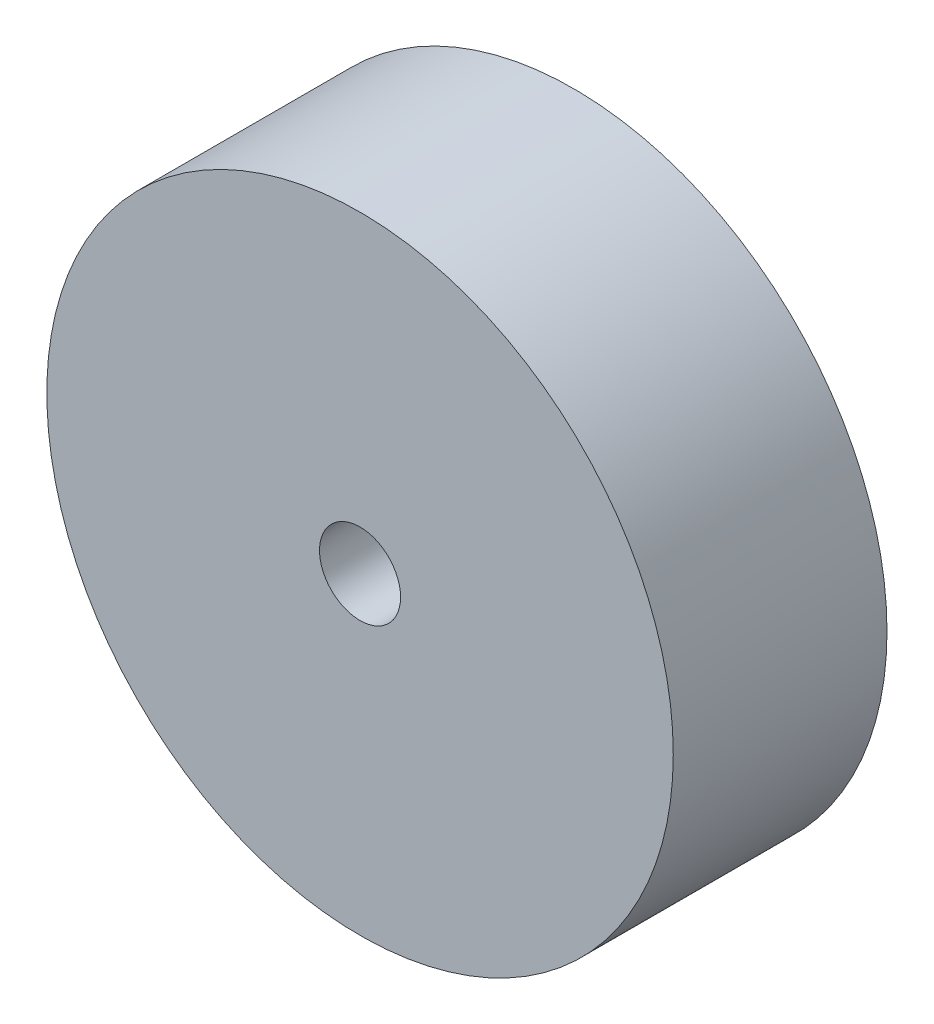
from build123d import *

# Parameters (mm, degrees)
SKETCH1_R           = 8.5
BOSS_EXTRUDE1_DEPTH = 5.8
SKETCH2_R           = 8
CUT_EXTRUDE1_DEPTH  = 3.2
SKETCH3_R           = 1
BOSS_EXTRUDE2_DEPTH = 3.2
CHAMFER1_SIZE       = 2.65
CHAMFER1_SIZE2      = 3.048476279
SKETCH4_R           = 2.1
BOSS_EXTRUDE3_DEPTH = 3
SKETCH5_R           = 0.85
CUT_EXTRUDE2_DEPTH  = 40.372371259
SKETCH6_R           = 1.1
CUT_EXTRUDE3_DEPTH  = 3


with BuildPart() as part:
    # Sketch1 → Boss-Extrude1 (new body)
    with BuildSketch(Plane.XY):
        with Locations((-29.082250471, -1.703826149)):
            Circle(SKETCH1_R)
    extrude(amount=BOSS_EXTRUDE1_DEPTH)

    # Sketch2 → Cut-Extrude1 (cut)
    with BuildSketch(Plane(origin=(0, 0, 0), x_dir=(-1, 0, 0), z_dir=(0, 0, -1))):
        with Locations((29.082250471, -1.703826149)):
            Circle(SKETCH2_R)
    extrude(amount=-CUT_EXTRUDE1_DEPTH, mode=Mode.SUBTRACT)

    # Sketch3 → Boss-Extrude2 (add)
    with BuildSketch(Plane(origin=(0, 0, 3.2), x_dir=(-1, 0, 0), z_dir=(0, 0, -1))):
        with Locations((29.082250471, -1.703826149)):
            Circle(SKETCH3_R)
    extrude(amount=BOSS_EXTRUDE2_DEPTH)

    # Chamfer1
    chamfer1_edges = [part.edges().sort_by_distance(p)[0] for p in [
        (-28.082250471, -1.703826149, 3.2),
    ]]
    chamfer1_side = [part.faces().sort_by_distance(p)[0] for p in [
        (-21.308524641, -1.703826149, 3.2),
    ]]
    chamfer(chamfer1_edges, length=CHAMFER1_SIZE, length2=CHAMFER1_SIZE2, reference=chamfer1_side[0])

    # Sketch4 → Boss-Extrude3 (add)
    with BuildSketch(Plane(origin=(0, 0, 0), x_dir=(-1, 0, 0), z_dir=(0, 0, -1))):
        with Locations((29.082250471, -1.703826149)):
            Circle(SKETCH4_R)
    extrude(amount=-BOSS_EXTRUDE3_DEPTH)

    # Sketch5 → Cut-Extrude2 (cut, through all)
    with BuildSketch(Plane(origin=(0, 0, 0), x_dir=(-1, 0, 0), z_dir=(0, 0, -1))):
        with Locations((29.082250471, -1.703826149)):
            Circle(SKETCH5_R)
    extrude(amount=-CUT_EXTRUDE2_DEPTH, mode=Mode.SUBTRACT)

    # Sketch6 → Cut-Extrude3 (cut)
    with BuildSketch(Plane.XY.offset(5.8)):
        with Locations((-29.082250471, -1.703826149)):
            Circle(SKETCH6_R)
    extrude(amount=-CUT_EXTRUDE3_DEPTH, mode=Mode.SUBTRACT)


solid = part.part
